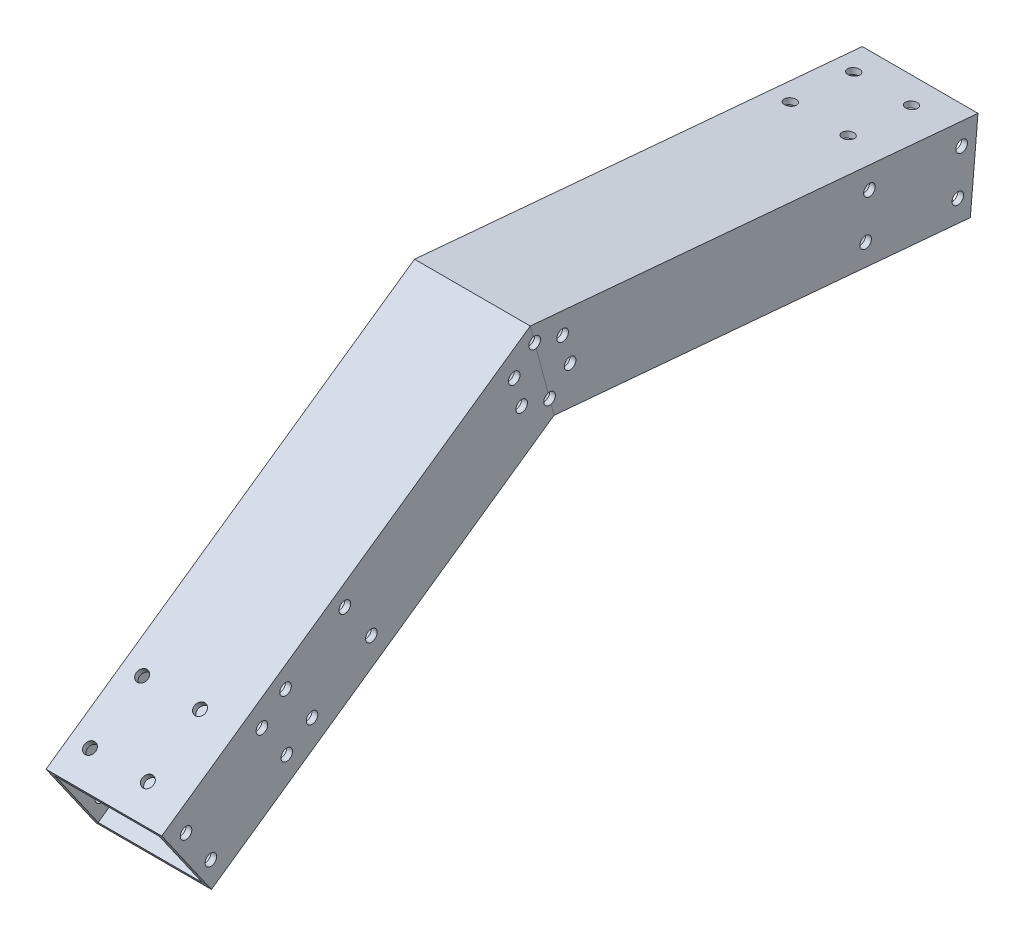
from build123d import *

# Parameters (mm, degrees)
SKETCH1_W                = 30
SKETCH1_H                = 40
SKETCH1_W_2              = 26
SKETCH1_H_2              = 36
F_20_X_20_X_2_1_DEPTH    = 160.159392621
SKETCH1_ON_SEGMENT_2_W   = 30
SKETCH1_ON_SEGMENT_2_H   = 40
SKETCH1_ON_SEGMENT_2_W_2 = 26
SKETCH1_ON_SEGMENT_2_H_2 = 36
F_20_X_20_X_2_1_2_DEPTH  = 160.159392621
SKETCH_3_R               = 2
CUT_EXTRUDE_1_DEPTH      = 50
SKETCH_4_R               = 2
CUT_EXTRUDE_2_DEPTH      = 50
SKETCH_5_R               = 2
CUT_EXTRUDE_3_DEPTH      = 167.538055882
SKETCH_6_R               = 2
CUT_EXTRUDE_4_DEPTH      = 167.538055882
SKETCH_7_R               = 2
CUT_EXTRUDE_5_DEPTH      = 167.538055882
SKETCH_8_R               = 2
CUT_EXTRUDE_6_DEPTH      = 167.538055882


with BuildPart() as part:
    # Sketch1 → 方形管 20 X 20 X 2(1) (new body)
    with BuildSketch(Plane(origin=(0, -42.556514737, 122.970952591), x_dir=(0, 0.8198063506063987, 0.5726408538564275), z_dir=(0, 0.5726408538564276, -0.8198063506063988))):
        with Locations((-0.273785359, 0)):
            Rectangle(SKETCH1_W, SKETCH1_H)
        with Locations((-0.273785359, 0)):
            Rectangle(SKETCH1_W_2, SKETCH1_H_2, mode=Mode.SUBTRACT)
    extrude(amount=F_20_X_20_X_2_1_DEPTH)

    # 方形管 20 X 20 X 2(1) mitre 1
    split(bisect_by=Plane(origin=(0, 43.339613341, 0), x_dir=(0, -0.966220685, -0.257716099), z_dir=(0, -0.257716099, 0.966220685)), keep=Keep.TOP)


with BuildPart() as body_2:
    # Sketch1 on segment 2 (carried to segment 2) → 20 X 20 X 2_1 2 (new body)
    with BuildSketch(Plane(origin=(0, 44.236616802, 10.11971557), x_dir=(0, 0.996094545, -0.088293021), z_dir=(0, -0.088293021, -0.996094545))):
        with Locations((-0.273785359, 0)):
            Rectangle(SKETCH1_ON_SEGMENT_2_W, SKETCH1_ON_SEGMENT_2_H)
        with Locations((-0.273785359, 0)):
            Rectangle(SKETCH1_ON_SEGMENT_2_W_2, SKETCH1_ON_SEGMENT_2_H_2, mode=Mode.SUBTRACT)
    extrude(amount=F_20_X_20_X_2_1_2_DEPTH)

    # 20 X 20 X 2_1 2 mitre 1
    split(bisect_by=Plane(origin=(0, 43.339613341, 0), x_dir=(0, 0.966220685, 0.257716099), z_dir=(0, 0.257716099, -0.966220685)), keep=Keep.TOP)


with BuildPart() as part_1:
    add(part.part)

    # 方形管 20 X 20 X 2(1) as one body: union body 2
    add(body_2.part)

    # 草图3 → 切除-拉伸1 (cut)
    with BuildSketch(Plane(origin=(0, 41.200437908, 28.778813344), x_dir=(1, 0, 0), z_dir=(0, 0.8198063506064069, 0.5726408538564159))):
        with Locations(Location((-13, -93.181966811, 0), (0, 0, 270))):
            Circle(SKETCH_3_R)
        with Locations(Location((7, -93.181966811, 0), (0, 0, 270))):
            Circle(SKETCH_3_R)
        with Locations(Location((7, -115.181966811, 0), (0, 0, 270))):
            Circle(SKETCH_3_R)
        with Locations(Location((-13, -115.181966811, 0), (0, 0, 270))):
            Circle(SKETCH_3_R)
    extrude(amount=-CUT_EXTRUDE_1_DEPTH, mode=Mode.SUBTRACT)

    # 草图4 → 切除-拉伸2 (cut)
    with BuildSketch(Plane(origin=(0, 57.670454633, -5.111862784), x_dir=(1, 0, 0), z_dir=(0, 0.9960945449749122, -0.08829302051251052))):
        with Locations(Location((-13, 136.17341463, 0), (0, 0, 270))):
            Circle(SKETCH_4_R)
        with Locations(Location((7, 136.17341463, 0), (0, 0, 270))):
            Circle(SKETCH_4_R)
        with Locations(Location((7, 114.17341463, 0), (0, 0, 270))):
            Circle(SKETCH_4_R)
        with Locations(Location((-13, 114.17341463, 0), (0, 0, 270))):
            Circle(SKETCH_4_R)
    extrude(amount=-CUT_EXTRUDE_2_DEPTH, mode=Mode.SUBTRACT)

    # 草图5 → 切除-拉伸3 (cut, through all)
    with BuildSketch(Plane(origin=(20, 0, 0), x_dir=(0, 0, -1), z_dir=(1, 0, 0))):
        with Locations((-88.617234765, -7.915947573)):
            Circle(SKETCH_5_R)
        with Locations((-68.122076, 6.400073774)):
            Circle(SKETCH_5_R)
        with Locations((-58.959822338, -6.716827836)):
            Circle(SKETCH_5_R)
        with Locations((-79.454981103, -21.032849183)):
            Circle(SKETCH_5_R)
    extrude(amount=-CUT_EXTRUDE_3_DEPTH, mode=Mode.SUBTRACT)

    # 草图6 → 切除-拉伸4 (cut, through all)
    with BuildSketch(Plane(origin=(20, 0, 0), x_dir=(0, 0, -1), z_dir=(1, 0, 0))):
        with Locations((-123.00994656, -33.769213815)):
            Circle(SKETCH_6_R)
        with Locations((-96.776143341, -15.444706491)):
            Circle(SKETCH_6_R)
        with Locations((-88.186530533, -27.74180175)):
            Circle(SKETCH_6_R)
        with Locations((-114.420333752, -46.066309074)):
            Circle(SKETCH_6_R)
    extrude(amount=-CUT_EXTRUDE_4_DEPTH, mode=Mode.SUBTRACT)

    # 草图7 → 切除-拉伸5 (cut, through all)
    with BuildSketch(Plane(origin=(20, 0, 0), x_dir=(0, 0, -1), z_dir=(1, 0, 0))):
        with Locations((145.071733339, 37.735118352)):
            Circle(SKETCH_7_R)
        with Locations((143.747338031, 22.793700177)):
            Circle(SKETCH_7_R)
        with Locations((111.872312592, 25.619076833)):
            Circle(SKETCH_7_R)
        with Locations((113.1967079, 40.560495008)):
            Circle(SKETCH_7_R)
    extrude(amount=-CUT_EXTRUDE_5_DEPTH, mode=Mode.SUBTRACT)

    # 草图8 → 切除-拉伸6 (cut, through all)
    with BuildSketch(Plane(origin=(20, 0, 0), x_dir=(0, 0, -1), z_dir=(1, 0, 0))):
        with Locations(Location((-2.502073785, 52.720305714, 0), (0, 0, 284.934586598))):
            Circle(SKETCH_8_R)
        with Locations((7.154223301, 50.121089178)):
            Circle(SKETCH_8_R)
        with Locations((9.731384293, 40.458882327)):
            Circle(SKETCH_8_R)
        with Locations(Location((2.652248199, 33.395892013, 0), (0, 0, 284.934586598))):
            Circle(SKETCH_8_R)
        with Locations((-7.004048886, 35.99510855)):
            Circle(SKETCH_8_R)
        with Locations((-9.581209878, 45.6573154)):
            Circle(SKETCH_8_R)
    extrude(amount=-CUT_EXTRUDE_6_DEPTH, mode=Mode.SUBTRACT)


solid = part_1.part
